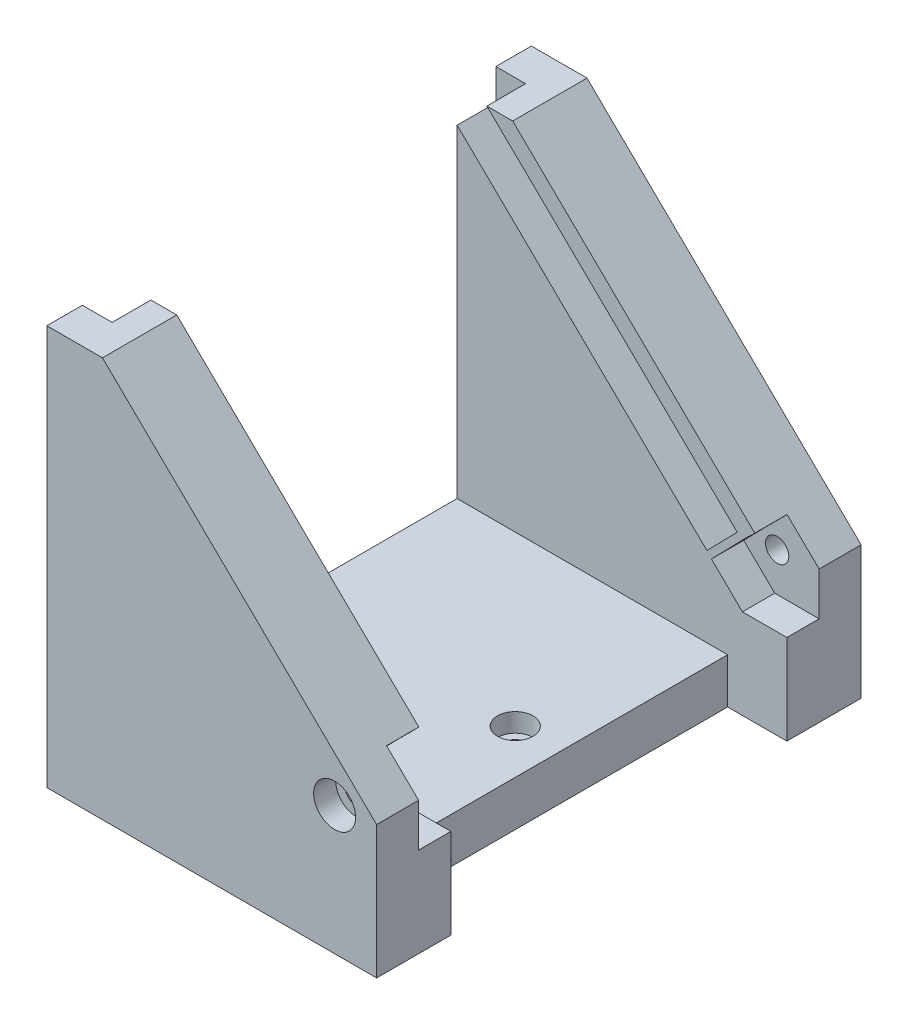
from build123d import *

# Parameters (mm, degrees)
BOSS_EXTRU_1_DEPTH                                 = 5.5
ESQUISSE1_3_R                                      = 1.8
BOSS_EXTRU_2_DEPTH                                 = 6.5
BOSS_EXTRU_3_DEPTH                                 = 11.5
ESQUISSE1_6_W                                      = 41.878391759
ESQUISSE1_6_H                                      = 7.003105655
BOSS_EXTRU_4_DEPTH                                 = 63.5
CHAMBRAGE_POUR_VIS_SIX_PANS_CREUX_M2_5_D           = 3.1
CHAMBRAGE_POUR_VIS_SIX_PANS_CREUX_M2_5_CBORE_D     = 5.5
CHAMBRAGE_POUR_VIS_SIX_PANS_CREUX_M2_5_CBORE_DEPTH = 2.9
CHAMBRAGE_POUR_VIS_SIX_PANS_CREUX_M31_D            = 3.6
CHAMBRAGE_POUR_VIS_SIX_PANS_CREUX_M31_CBORE_D      = 6.5
CHAMBRAGE_POUR_VIS_SIX_PANS_CREUX_M31_CBORE_DEPTH  = 3.4


with BuildPart() as part:
    # Esquisse1 → Boss.-Extru.1 (new body)
    with BuildSketch(Plane.XY):
        Polygon((-51.041668631, 61.918561392), (-51.041668631, 57.051835463), (-12.364240457, 19.369216184), (-7.689286801, 24.167587096), (-46.436874542, 61.918561392), align=None)
    extrude(amount=BOSS_EXTRU_1_DEPTH)



with BuildPart() as body_2:
    # Esquisse1<3> → Boss.-Extru.2 (new body)
    with BuildSketch(Plane.XY):
        Polygon((-6.8709698, 13.899199983), (0, 13.899199983), (0, 20.573191179), (-4.963123823, 25.408660192), (-5.800119712, 24.549567884), (-5.832093395, 24.580719183), (-11.676946527, 18.581563828), align=None)
        with Locations((-6.5, 19.899199983)):
            Circle(ESQUISSE1_3_R, mode=Mode.SUBTRACT)
    extrude(amount=BOSS_EXTRU_2_DEPTH)


with BuildPart() as part_1:
    add(part.part)

    add(body_2.part)  # Boss.-Extru.3 merges body 2
    # Esquisse1<5> → Boss.-Extru.3 (add)
    with BuildSketch(Plane.XY):
        Polygon((-9.163276872, 0), (0, 0), (0, 13.899199983), (-6.8709698, 13.899199983), (-11.676946527, 18.581563828), (-5.832093395, 24.580719183), (-5.800119712, 24.549567884), (-4.963123823, 25.408660192), (-42.436874542, 61.918561392), (-46.436874542, 61.918561392), (-7.689286801, 24.167587096), (-12.364240457, 19.369216184), (-51.041668631, 57.051835463), (-51.041668631, 7.003105655), (-9.163276872, 7.003105655), align=None)
    extrude(amount=BOSS_EXTRU_3_DEPTH)

    # Esquisse1<6> → Boss.-Extru.4 (add)
    with BuildSketch(Plane.XY):
        with Locations((-30.102472752, 3.501552828)):
            Rectangle(ESQUISSE1_6_W, ESQUISSE1_6_H)
    extrude(amount=BOSS_EXTRU_4_DEPTH)

    # Symétrie2: part across plane


with BuildPart() as part_2:
    add(part_1.part)
    add(part_1.part.mirror(Plane.XY.offset(37.5)))

    # Chambrage pour vis à six pans creux M2.51 (through all)
    with Locations(Plane(origin=(0, 7.003105655, 0), x_dir=(1, 0, 0), z_dir=(0, 1, 0))):
        with Locations((-45.041668631, -37.5), (-16.041668631, -37.5)):
            CounterBoreHole(CHAMBRAGE_POUR_VIS_SIX_PANS_CREUX_M2_5_D / 2, CHAMBRAGE_POUR_VIS_SIX_PANS_CREUX_M2_5_CBORE_D / 2, CHAMBRAGE_POUR_VIS_SIX_PANS_CREUX_M2_5_CBORE_DEPTH)

    # Chambrage pour vis à six pans creux M31 (through all)
    with Locations(Plane(origin=(0, 0, 0), x_dir=(-1, 0, 0), z_dir=(0, 0, -1))):
        with Locations((6.5, 19.899199983)):
            chambrage_pour_vis_six_pans_creux_m31 = CounterBoreHole(CHAMBRAGE_POUR_VIS_SIX_PANS_CREUX_M31_D / 2, CHAMBRAGE_POUR_VIS_SIX_PANS_CREUX_M31_CBORE_D / 2, CHAMBRAGE_POUR_VIS_SIX_PANS_CREUX_M31_CBORE_DEPTH)

    # Symétrie3: Chambrage pour vis à six pans creux M31 across plane
    add(chambrage_pour_vis_six_pans_creux_m31.mirror(Plane.XY.offset(37.5)), mode=Mode.SUBTRACT)


solid = part_2.part
